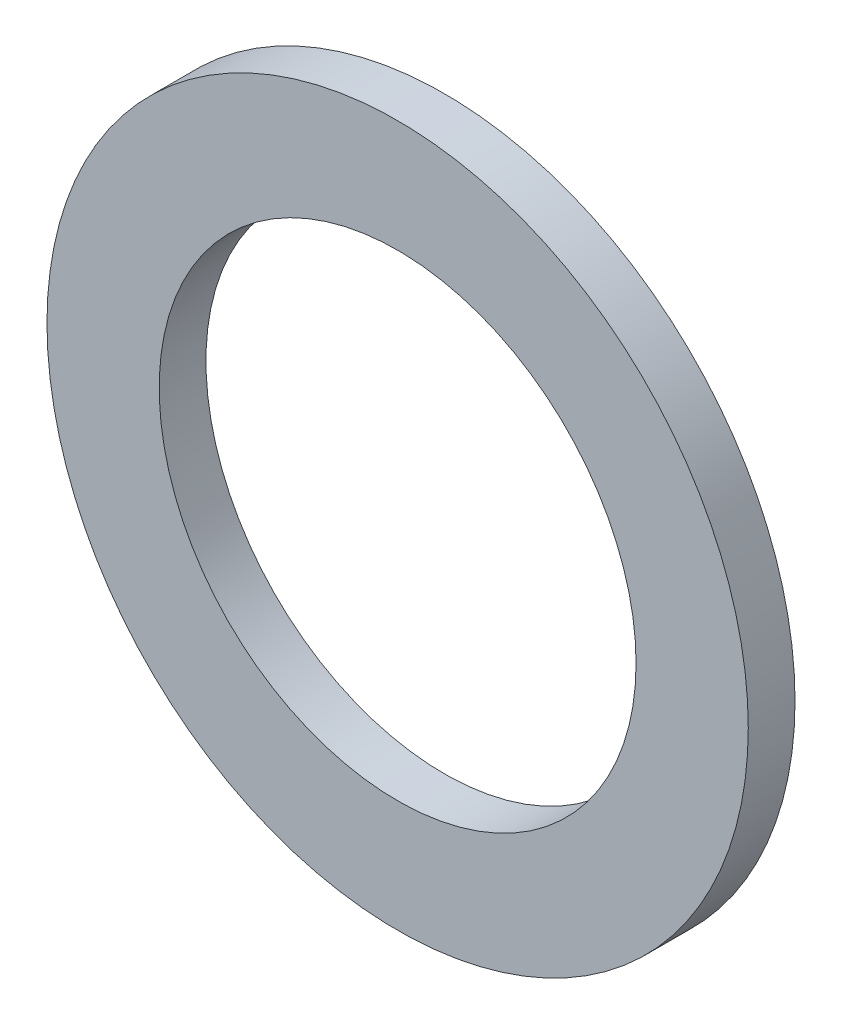
from build123d import *

# Parameters (mm, degrees)
SKETCH_1_R      = 7.5
SKETCH_1_R_2    = 5.1
EXTRUDE_1_DEPTH = 1


with BuildPart() as part:
    # 草图1 → 凸台-拉伸1 (new body)
    with BuildSketch(Plane.XY):
        Circle(SKETCH_1_R)
        Circle(SKETCH_1_R_2, mode=Mode.SUBTRACT)
    extrude(amount=EXTRUDE_1_DEPTH)


solid = part.part
